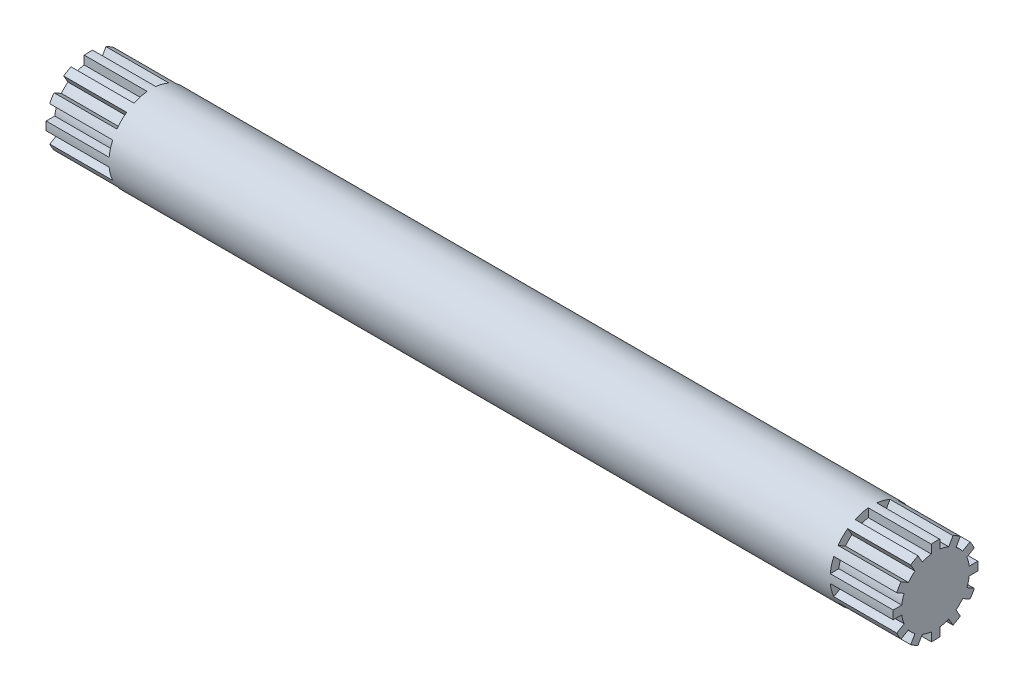
from build123d import *

# Parameters (mm, degrees)
SKETCH1_R           = 2.5
BOSS_EXTRUDE1_DEPTH = 49.8
CUT_EXTRUDE2_DEPTH  = 3.7


with BuildPart() as part:
    # Sketch1 → Boss-Extrude1 (new body)
    with BuildSketch(Plane(origin=(0, 0, 0), x_dir=(0, 0, -1), z_dir=(1, 0, 0))):
        Circle(SKETCH1_R)
    extrude(amount=BOSS_EXTRUDE1_DEPTH)

    # Sketch3 → Cut-Extrude2 (cut)
    with BuildSketch(Plane.ZY):
        with BuildLine():
            Line((-2.537715508, -0.25), (-1.984313483, -0.25))
            ThreePointArc((-1.984313483, -0.25), (-1.931851653, -0.51763809), (-1.843465886, -0.775650391))
            Line((-1.843465886, -0.775650391), (-2.322726098, -1.052351403))
            ThreePointArc((-2.322726098, -1.052351403), (-2.463110857, -0.659988565), (-2.537715508, -0.25))
        make_face()
        with BuildLine():
            Line((-2.537715508, 0.25), (-1.984313483, 0.25))
            ThreePointArc((-1.984313483, 0.25), (-1.931851653, 0.51763809), (-1.843465886, 0.775650391))
            Line((-1.843465886, 0.775650391), (-2.322726098, 1.052351403))
            ThreePointArc((-2.322726098, 1.052351403), (-2.463110857, 0.659988565), (-2.537715508, 0.25))
        make_face()
        with BuildLine():
            Line((-2.072726098, 1.485364105), (-1.593465886, 1.208663093))
            ThreePointArc((-1.593465886, 1.208663093), (-1.414213562, 1.414213562), (-1.208663093, 1.593465886))
            Line((-1.208663093, 1.593465886), (-1.485364105, 2.072726098))
            ThreePointArc((-1.485364105, 2.072726098), (-1.803122292, 1.803122292), (-2.072726098, 1.485364105))
        make_face()
        with BuildLine():
            Line((-1.052351403, 2.322726098), (-0.775650391, 1.843465886))
            ThreePointArc((-0.775650391, 1.843465886), (-0.51763809, 1.931851653), (-0.25, 1.984313483))
            Line((-0.25, 1.984313483), (-0.25, 2.537715508))
            ThreePointArc((-0.25, 2.537715508), (-0.659988565, 2.463110857), (-1.052351403, 2.322726098))
        make_face()
        with BuildLine():
            Line((0.25, 2.537715508), (0.25, 1.984313483))
            ThreePointArc((0.25, 1.984313483), (0.51763809, 1.931851653), (0.775650391, 1.843465886))
            Line((0.775650391, 1.843465886), (1.052351403, 2.322726098))
            ThreePointArc((1.052351403, 2.322726098), (0.659988565, 2.463110857), (0.25, 2.537715508))
        make_face()
        with BuildLine():
            Line((1.485364105, 2.072726098), (1.208663093, 1.593465886))
            ThreePointArc((1.208663093, 1.593465886), (1.414213562, 1.414213562), (1.593465886, 1.208663093))
            Line((1.593465886, 1.208663093), (2.072726098, 1.485364105))
            ThreePointArc((2.072726098, 1.485364105), (1.803122292, 1.803122292), (1.485364105, 2.072726098))
        make_face()
        with BuildLine():
            Line((2.322726098, 1.052351403), (1.843465886, 0.775650391))
            ThreePointArc((1.843465886, 0.775650391), (1.931851653, 0.51763809), (1.984313483, 0.25))
            Line((1.984313483, 0.25), (2.537715508, 0.25))
            ThreePointArc((2.537715508, 0.25), (2.463110857, 0.659988565), (2.322726098, 1.052351403))
        make_face()
        with BuildLine():
            Line((2.537715508, -0.25), (1.984313483, -0.25))
            ThreePointArc((1.984313483, -0.25), (1.931851653, -0.51763809), (1.843465886, -0.775650391))
            Line((1.843465886, -0.775650391), (2.322726098, -1.052351403))
            ThreePointArc((2.322726098, -1.052351403), (2.463110857, -0.659988565), (2.537715508, -0.25))
        make_face()
        with BuildLine():
            Line((2.072726098, -1.485364105), (1.593465886, -1.208663093))
            ThreePointArc((1.593465886, -1.208663093), (1.414213562, -1.414213562), (1.208663093, -1.593465886))
            Line((1.208663093, -1.593465886), (1.485364105, -2.072726098))
            ThreePointArc((1.485364105, -2.072726098), (1.803122292, -1.803122292), (2.072726098, -1.485364105))
        make_face()
        with BuildLine():
            Line((1.052351403, -2.322726098), (0.775650391, -1.843465886))
            ThreePointArc((0.775650391, -1.843465886), (0.51763809, -1.931851653), (0.25, -1.984313483))
            Line((0.25, -1.984313483), (0.25, -2.537715508))
            ThreePointArc((0.25, -2.537715508), (0.659988565, -2.463110857), (1.052351403, -2.322726098))
        make_face()
        with BuildLine():
            Line((-0.25, -2.537715508), (-0.25, -1.984313483))
            ThreePointArc((-0.25, -1.984313483), (-0.51763809, -1.931851653), (-0.775650391, -1.843465886))
            Line((-0.775650391, -1.843465886), (-1.052351403, -2.322726098))
            ThreePointArc((-1.052351403, -2.322726098), (-0.659988565, -2.463110857), (-0.25, -2.537715508))
        make_face()
        with BuildLine():
            Line((-1.485364105, -2.072726098), (-1.208663093, -1.593465886))
            ThreePointArc((-1.208663093, -1.593465886), (-1.414213562, -1.414213562), (-1.593465886, -1.208663093))
            Line((-1.593465886, -1.208663093), (-2.072726098, -1.485364105))
            ThreePointArc((-2.072726098, -1.485364105), (-1.803122292, -1.803122292), (-1.485364105, -2.072726098))
        make_face()
    cut_extrude2 = extrude(amount=-CUT_EXTRUDE2_DEPTH, mode=Mode.SUBTRACT)

    # Mirror1: Cut-Extrude2 across plane
    add(cut_extrude2.mirror(Plane(origin=(24.9, 0, 0), x_dir=(0, 0, 1), z_dir=(1, 0, 0))), mode=Mode.SUBTRACT)


solid = part.part
